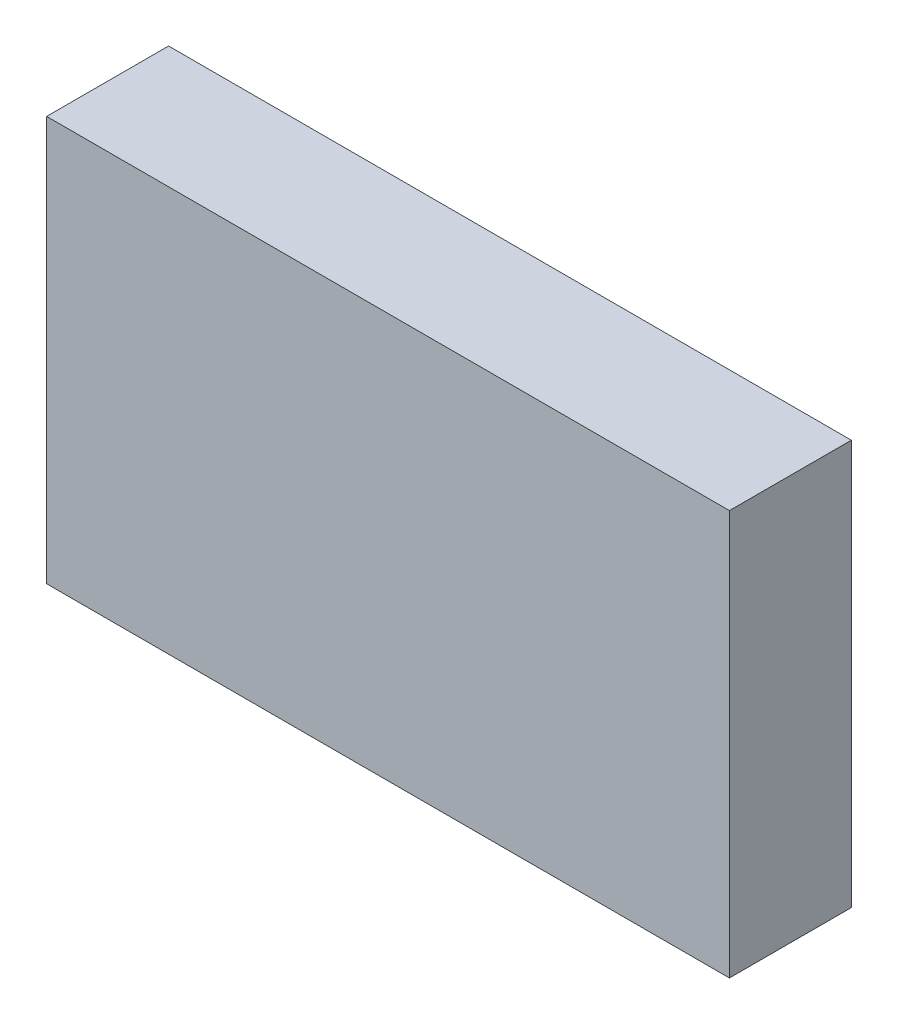
from build123d import *

# Parameters (mm, degrees)
SKETCH_1_W      = 140
SKETCH_1_H      = 83
EXTRUDE_1_DEPTH = 25


with BuildPart() as part:
    # 草图1 → 凸台-拉伸1 (new body)
    with BuildSketch(Plane.XY):
        Rectangle(SKETCH_1_W, SKETCH_1_H)
    extrude(amount=EXTRUDE_1_DEPTH)


solid = part.part
